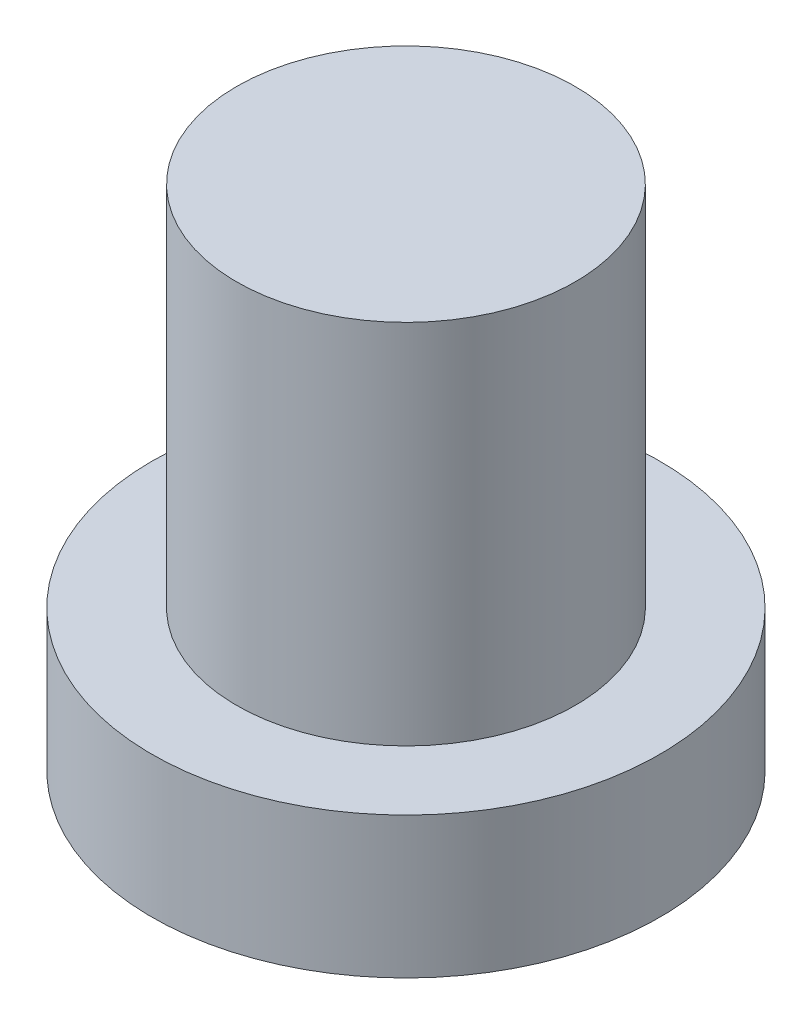
from build123d import *


with BuildPart() as part:
    # Sketch1 → Revolve1 (revolve)
    with BuildSketch(Plane.XY, mode=Mode.PRIVATE) as revolve1_sk:
        Polygon((0, 0), (9, 0), (9, 5), (6, 5), (6, 18), (0, 18), align=None)
    revolve(revolve1_sk.sketch.rotate(Axis((0, 23, 0), (0, -1, 0)), 180), axis=Axis((0, 23, 0), (0, -1, 0)))


solid = part.part
